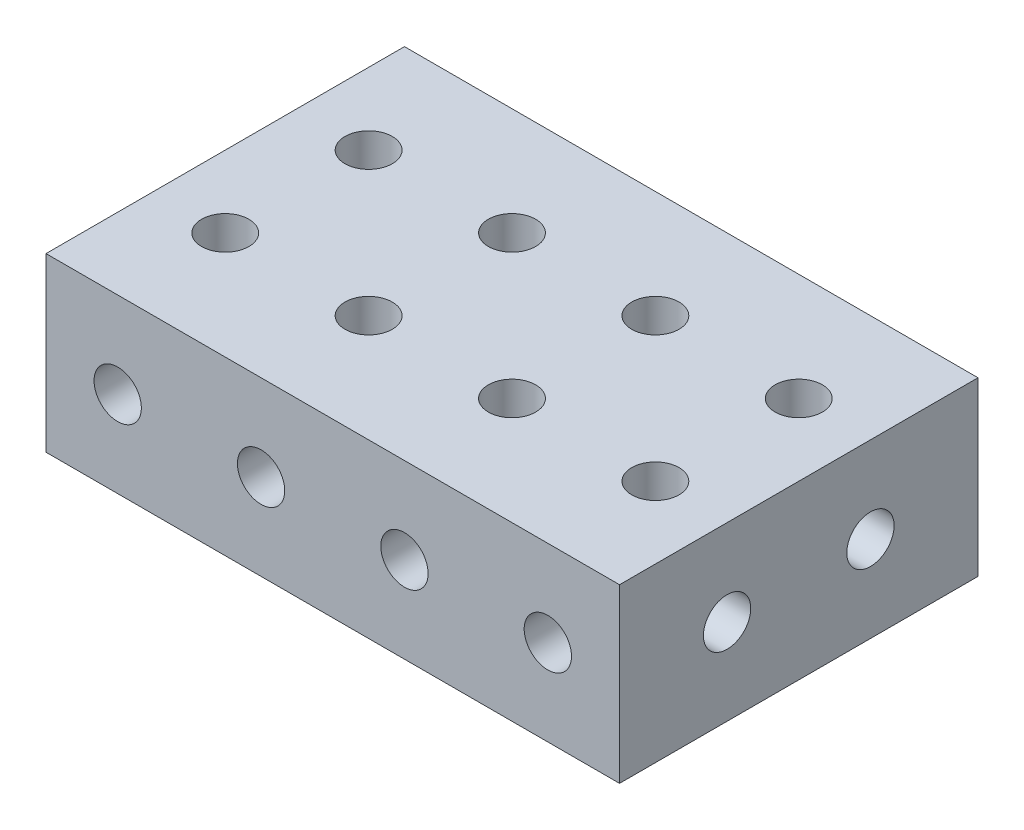
from build123d import *

# Parameters (mm, degrees)
ESQUISSE1_W             = 25
ESQUISSE1_H             = 12
BOSS_EXTRU_1_DEPTH      = 40
ESQUISSE2_R             = 1.65
ENL_V_MAT_EXTRU_1_DEPTH = 49.672374095
ESQUISSE3_R             = 1.65
ENL_V_MAT_EXTRU_2_DEPTH = 40
ESQUISSE4_R             = 1.65
ENL_V_MAT_EXTRU_3_DEPTH = 40


with BuildPart() as part:
    # Esquisse1 → Boss.-Extru.1 (new body)
    with BuildSketch(Plane(origin=(0, 0, 0), x_dir=(0, 0, -1), z_dir=(1, 0, 0))):
        with Locations((12.5, 6)):
            Rectangle(ESQUISSE1_W, ESQUISSE1_H)
    extrude(amount=BOSS_EXTRU_1_DEPTH)

    # Esquisse2 → Enlèv. mat.-Extru.1 (cut, through all)
    with BuildSketch(Plane(origin=(0, 12, 0), x_dir=(1, 0, 0), z_dir=(0, 1, 0))):
        with Locations(Location((5, 17.5, 0), (0, 0, 270))):
            Circle(ESQUISSE2_R)
        with Locations(Location((15, 17.5, 0), (0, 0, 270))):
            Circle(ESQUISSE2_R)
        with Locations(Location((25, 17.5, 0), (0, 0, 270))):
            Circle(ESQUISSE2_R)
        with Locations(Location((35, 17.5, 0), (0, 0, 270))):
            Circle(ESQUISSE2_R)
        with Locations(Location((5, 7.5, 0), (0, 0, 270))):
            Circle(ESQUISSE2_R)
        with Locations(Location((15, 7.5, 0), (0, 0, 270))):
            Circle(ESQUISSE2_R)
        with Locations(Location((35, 7.5, 0), (0, 0, 270))):
            Circle(ESQUISSE2_R)
        with Locations(Location((25, 7.5, 0), (0, 0, 270))):
            Circle(ESQUISSE2_R)
    extrude(amount=-ENL_V_MAT_EXTRU_1_DEPTH, mode=Mode.SUBTRACT)

    # Esquisse3 → Enlèv. mat.-Extru.2 (cut)
    with BuildSketch(Plane.XY):
        with Locations((5, 6)):
            Circle(ESQUISSE3_R)
        with Locations((15, 6)):
            Circle(ESQUISSE3_R)
        with Locations((25, 6)):
            Circle(ESQUISSE3_R)
        with Locations((35, 6)):
            Circle(ESQUISSE3_R)
    extrude(amount=-ENL_V_MAT_EXTRU_2_DEPTH, mode=Mode.SUBTRACT)

    # Esquisse4 → Enlèv. mat.-Extru.3 (cut)
    with BuildSketch(Plane(origin=(40, 0, 0), x_dir=(0, 0, -1), z_dir=(1, 0, 0))):
        with Locations(Location((17.5, 6, 0), (0, 0, 315))):
            Circle(ESQUISSE4_R)
        with Locations(Location((7.5, 6, 0), (0, 0, 315))):
            Circle(ESQUISSE4_R)
    extrude(amount=-ENL_V_MAT_EXTRU_3_DEPTH, mode=Mode.SUBTRACT)


solid = part.part
